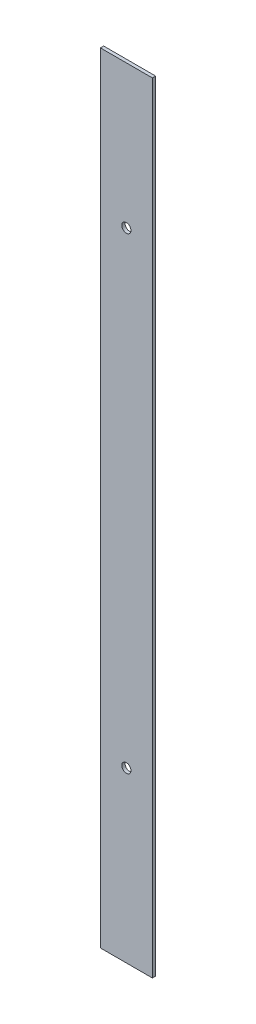
from build123d import *

# Parameters (mm, degrees)
SKETCH1_W           = 25.4
SKETCH1_H           = 381
SKETCH1_R           = 2.25
BOSS_EXTRUDE1_DEPTH = 1.5875


with BuildPart() as part:
    # Sketch1 → Boss-Extrude1 (new body)
    with BuildSketch(Plane.XY):
        with Locations((12.7, 190.5)):
            Rectangle(SKETCH1_W, SKETCH1_H)
        with Locations((12.7, 82.55)):
            Circle(SKETCH1_R, mode=Mode.SUBTRACT)
        with Locations((12.7, 311.15)):
            Circle(SKETCH1_R, mode=Mode.SUBTRACT)
    extrude(amount=BOSS_EXTRUDE1_DEPTH)


solid = part.part
